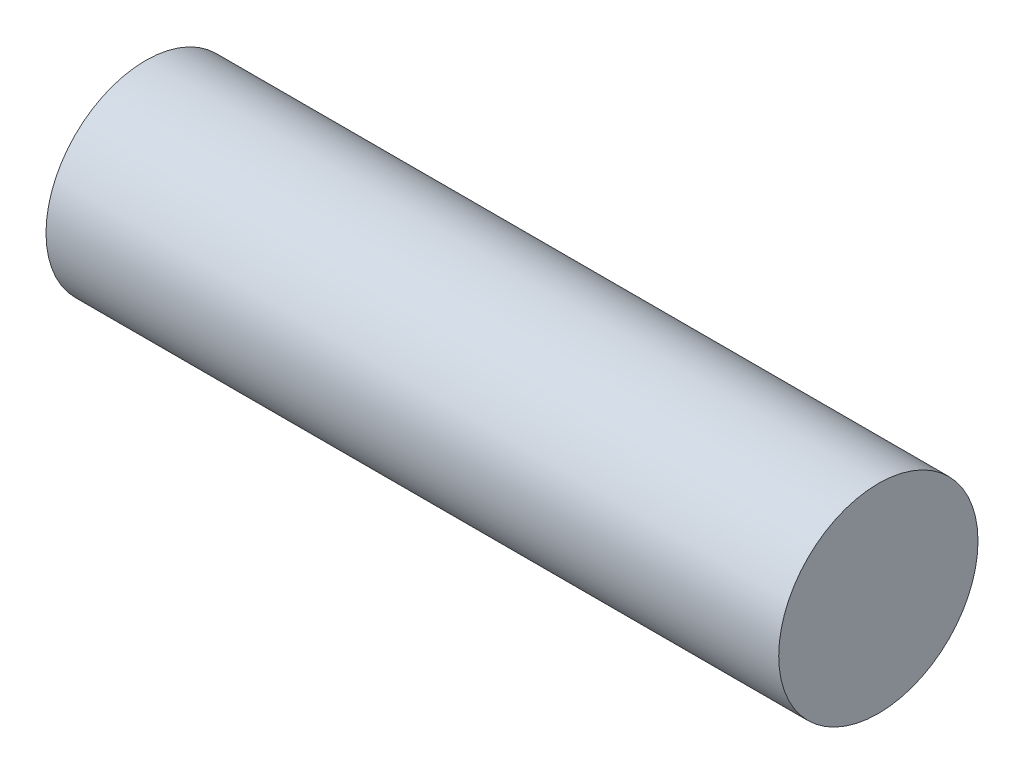
from build123d import *

# Parameters (mm, degrees)
SKETCH1_R           = 34
BOSS_EXTRUDE1_DEPTH = 250


with BuildPart() as part:
    # Sketch1 → Boss-Extrude1 (new body)
    with BuildSketch(Plane(origin=(0, 0, 0), x_dir=(0, 0, -1), z_dir=(1, 0, 0))):
        Circle(SKETCH1_R)
    extrude(amount=BOSS_EXTRUDE1_DEPTH)


solid = part.part
